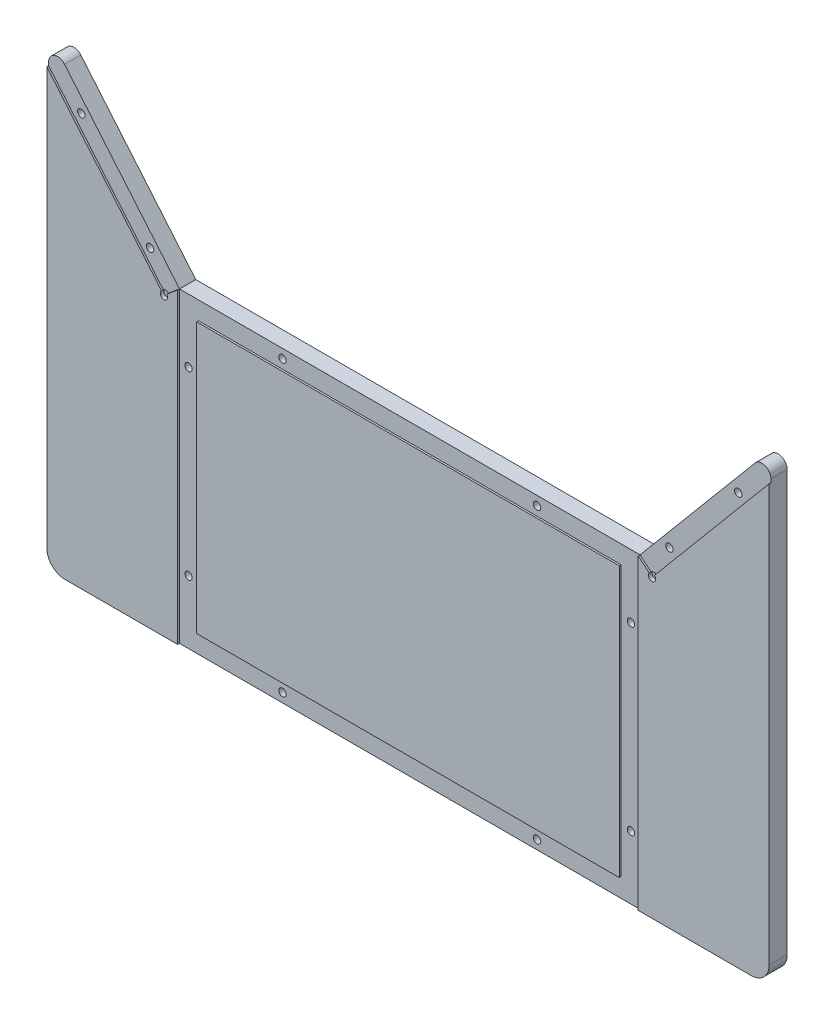
from build123d import *

# Parameters (mm, degrees)
BOSS_EXTRUDE2_DEPTH     = 10
ESQUISSE2_W             = 255
ESQUISSE2_H             = 170
ESQUISSE2_W_2           = 234
ESQUISSE2_H_2           = 149.5
ENL_V_MAT_EXTRU_1_DEPTH = 1
ENL_V_MAT_EXTRU_2_DEPTH = 1
CONG_1_R                = 10
CONG_2_R                = 10
CONG_3_R                = 5
CONG_4_R                = 5
ESQUISSE5_R             = 2
ENL_V_MAT_EXTRU_3_DEPTH = 2
ESQUISSE6_R             = 2.05
ENL_V_MAT_EXTRU_4_DEPTH = 10
ESQUISSE7_R             = 2.05
ENL_V_MAT_EXTRU_5_DEPTH = 10


with BuildPart() as part:
    # Sketch1 → Boss-Extrude2 (new body)
    with BuildSketch(Plane.XY):
        Polygon((-200, 0), (200, 0), (200, 170), (200, 256.402135463), (127.5, 170), (-127.5, 170), (-200, 256.402135463), (-200, 170), align=None)
    extrude(amount=BOSS_EXTRUDE2_DEPTH)

    # Esquisse2 → Enlèv. mat.-Extru.1 (cut)
    with BuildSketch(Plane.XY.offset(10)):
        with Locations((0, 85)):
            Rectangle(ESQUISSE2_W, ESQUISSE2_H)
        with Locations((0, 85.25)):
            Rectangle(ESQUISSE2_W_2, ESQUISSE2_H_2, mode=Mode.SUBTRACT)
    extrude(amount=-ENL_V_MAT_EXTRU_1_DEPTH, mode=Mode.SUBTRACT)

    # Esquisse3 → Enlèv. mat.-Extru.2 (cut)
    with BuildSketch(Plane.XY.offset(10)):
        Polygon((127.5, 170), (135.160444431, 163.572123903), (200, 240.844897194), (200, 256.402135463), align=None)
        Polygon((-200, 256.402135463), (-127.5, 170), (-135.160444431, 163.572123903), (-200, 240.844897194), align=None)
    extrude(amount=-ENL_V_MAT_EXTRU_2_DEPTH, mode=Mode.SUBTRACT)

    # Congé1
    cong_1_edges = [part.edges().sort_by_distance(p)[0] for p in [
        (200, 0, 5),
    ]]
    fillet(cong_1_edges, radius=CONG_1_R)

    # Congé2
    cong_2_edges = [part.edges().sort_by_distance(p)[0] for p in [
        (-200, 0, 5),
    ]]
    fillet(cong_2_edges, radius=CONG_2_R)

    # Congé3
    cong_3_edges = [part.edges().sort_by_distance(p)[0] for p in [
        (-200, 256.402135463, 4.5),
    ]]
    fillet(cong_3_edges, radius=CONG_3_R)

    # Congé4
    cong_4_edges = [part.edges().sort_by_distance(p)[0] for p in [
        (200, 256.402135463, 4.5),
    ]]
    fillet(cong_4_edges, radius=CONG_4_R)

    # Esquisse5 → Enlèv. mat.-Extru.3 (cut)
    with BuildSketch(Plane.XY.offset(10)):
        with Locations((-135.160444431, 163.572123903)):
            Circle(ESQUISSE5_R)
        with Locations(Location((135.160444431, 163.572123903, 0), (0, 0, 50))):
            Circle(ESQUISSE5_R)
    extrude(amount=-ENL_V_MAT_EXTRU_3_DEPTH, mode=Mode.SUBTRACT)

    # Esquisse6 → Enlèv. mat.-Extru.4 (cut)
    with BuildSketch(Plane(origin=(0, 0, 0), x_dir=(-1, 0, 0), z_dir=(0, 0, -1))):
        with Locations((-70.5, 165)):
            Circle(ESQUISSE6_R)
        with Locations((-122.5, 135)):
            Circle(ESQUISSE6_R)
        with Locations(Location((122.5, 135, 0), (0, 0, 180))):
            Circle(ESQUISSE6_R)
        with Locations(Location((70.5, 165, 0), (0, 0, 180))):
            Circle(ESQUISSE6_R)
        with Locations((70.5, 5)):
            Circle(ESQUISSE6_R)
        with Locations((122.5, 35)):
            Circle(ESQUISSE6_R)
        with Locations(Location((-122.5, 35, 0), (0, 0, 180))):
            Circle(ESQUISSE6_R)
        with Locations(Location((-70.5, 5, 0), (0, 0, 180))):
            Circle(ESQUISSE6_R)
    extrude(amount=-ENL_V_MAT_EXTRU_4_DEPTH, mode=Mode.SUBTRACT)

    # Esquisse7 → Enlèv. mat.-Extru.5 (cut)
    with BuildSketch(Plane(origin=(0, 0, 0), x_dir=(-1, 0, 0), z_dir=(0, 0, -1))):
        with Locations((143.777848565, 181.620565373)):
            Circle(ESQUISSE7_R)
        with Locations(Location((181.870852493, 227.018039657, 0), (0, 0, 180))):
            Circle(ESQUISSE7_R)
        with Locations((-181.870852493, 227.018039657)):
            Circle(ESQUISSE7_R)
        with Locations(Location((-143.777848565, 181.620565373, 0), (0, 0, 180))):
            Circle(ESQUISSE7_R)
    extrude(amount=-ENL_V_MAT_EXTRU_5_DEPTH, mode=Mode.SUBTRACT)


solid = part.part
